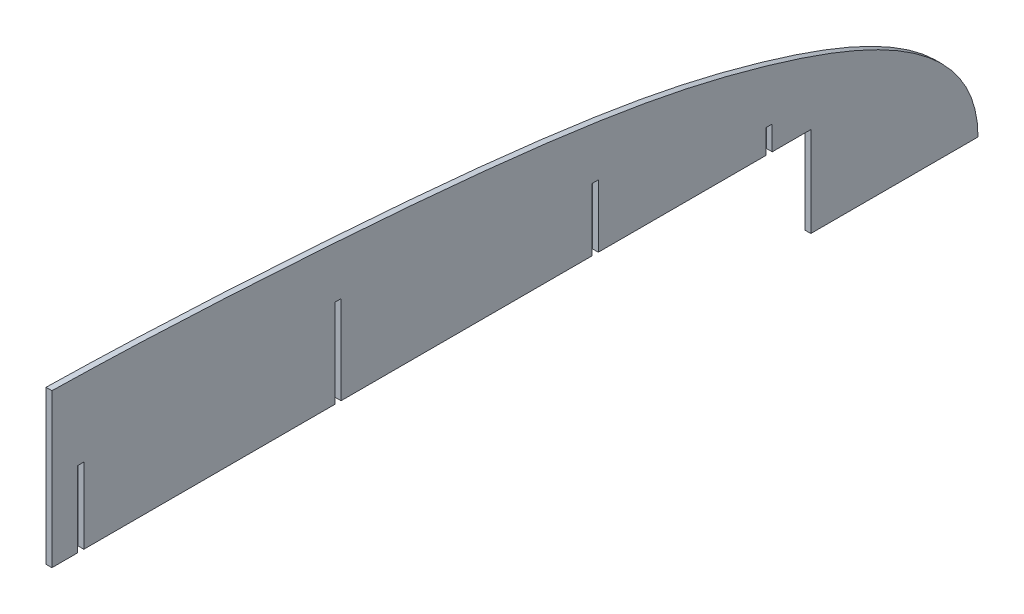
from build123d import *

# Parameters (mm, degrees)
BOSS_EXTRUDE1_DEPTH = 2.921
CUT_EXTRUDE1_DEPTH  = 1488.311355111


with BuildPart() as part:
    # Sketch2 → Boss-Extrude1 (new, symmetric)
    with BuildSketch(Plane(origin=(0, 0, 0), x_dir=(0, 0, -1), z_dir=(1, 0, 0))):
        with BuildLine():
            Line((-1460.5, 39.6875), (381, 39.6875))
            add(Edge.make_bspline(
                [(-1460.5, 39.6875), (-1460.5, 123.854582151), (-1400.448958782, 238.643618873), (-1168.264534851, 278.653196971), (-889.863220578, 278.192638574), (-549.517003244, 284.069445788), (-254.872972463, 268.16247247), (-19.653982034, 247.753440535), (192.838300002, 207.087014824), (381, 130.986638489), (381, 39.6875)],
                knots=[0, 0, 0, 0, 0.114447643, 0.153235008, 0.341616396, 0.529762749, 0.655350341, 0.781406837, 0.871201698, 1, 1, 1, 1], degree=3))
        make_face()
    extrude(amount=BOSS_EXTRUDE1_DEPTH, both=True)

    # Sketch3 → Cut-Extrude1 (cut, through all)
    with BuildSketch(Plane(origin=(2.921, 0, 0), x_dir=(0, 0, -1), z_dir=(1, 0, 0))):
        Polygon((215.9, 39.6875), (215.9, 128.5875), (177.8, 128.5875), (177.8, 152.4), (171.704, 152.4), (171.704, 128.5875), (6.096, 128.5875), (6.096, 190.5), (0, 190.5), (0, 128.5875), (-247.904, 128.5875), (-247.904, 215.9), (-254, 215.9), (-254, 128.5875), (-501.904, 128.5875), (-501.904, 203.2), (-508, 203.2), (-508, 128.5875), (-533.4, 128.5875), (-533.4, 394.349763682), (-1608.850266825, 394.349763682), (-1608.850266825, 39.6875), align=None)
    extrude(amount=-CUT_EXTRUDE1_DEPTH, mode=Mode.SUBTRACT)


solid = part.part
